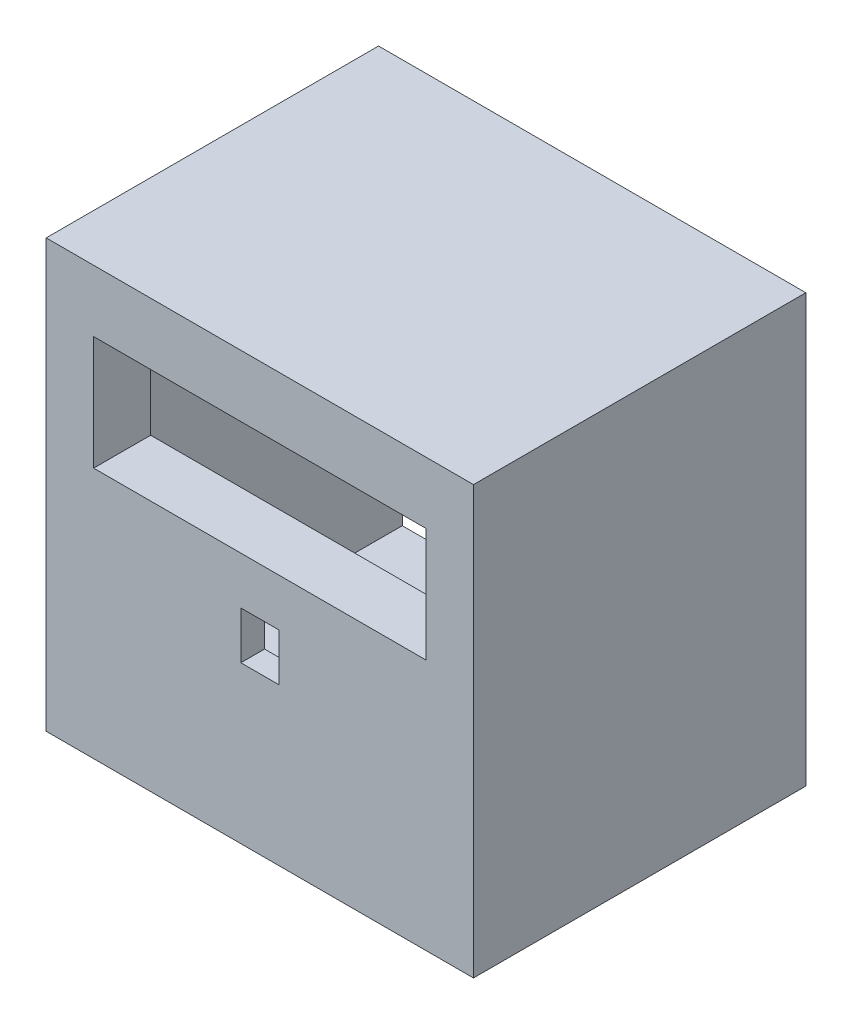
from build123d import *

# Parameters (mm, degrees)
SKETCH1_W           = 90
SKETCH1_H           = 90
BOSS_EXTRUDE1_DEPTH = 70
SHELL2_T            = -5
CUT_EXTRUDE1_REACH  = 96.604
SKETCH2_W           = 70
SKETCH2_H           = 24
BOSS_EXTRUDE2_DEPTH = 7
SKETCH5_W           = 8
SKETCH5_H           = 10
CUT_EXTRUDE2_DEPTH  = 10


with BuildPart() as part:
    # Sketch1 → Boss-Extrude1 (new body)
    with BuildSketch(Plane.XY):
        Rectangle(SKETCH1_W, SKETCH1_H)
    extrude(amount=BOSS_EXTRUDE1_DEPTH)

    # Shell2
    shell2_openings = [part.faces().sort_by_distance(p)[0] for p in [
        (0, 0, 0),
    ]]
    offset(amount=SHELL2_T, openings=shell2_openings, kind=Kind.INTERSECTION)

    # Sketch2 → Cut-Extrude1 (cut, up to next)
    with BuildSketch(Plane.XY.offset(70), mode=Mode.PRIVATE) as cut_extrude1_sk1:
        with Locations((0, 20)):
            Rectangle(SKETCH2_W, SKETCH2_H)
    cut_extrude1_tool1 = extrude(cut_extrude1_sk1.sketch, amount=-CUT_EXTRUDE1_REACH, mode=Mode.PRIVATE) & part.part
    add(cut_extrude1_tool1.solids().sort_by_distance((0, 20, 70))[0], mode=Mode.SUBTRACT)

    # Sketch4 → Boss-Extrude2 (add)
    with BuildSketch(Plane(origin=(0, 0, 65), x_dir=(-1, 0, 0), z_dir=(0, 0, -1))):
        Polygon((-40, 38), (-40, 32), (-35, 32), (35, 32), (35, 8), (-35, 8), (-40, 8), (-40, 2), (40, 2), (40, 38), align=None)
    extrude(amount=BOSS_EXTRUDE2_DEPTH)

    # Sketch5 → Cut-Extrude2 (cut)
    with BuildSketch(Plane.XY.offset(70)):
        with Locations((0, -7)):
            Rectangle(SKETCH5_W, SKETCH5_H)
    extrude(amount=-CUT_EXTRUDE2_DEPTH, mode=Mode.SUBTRACT)


solid = part.part
